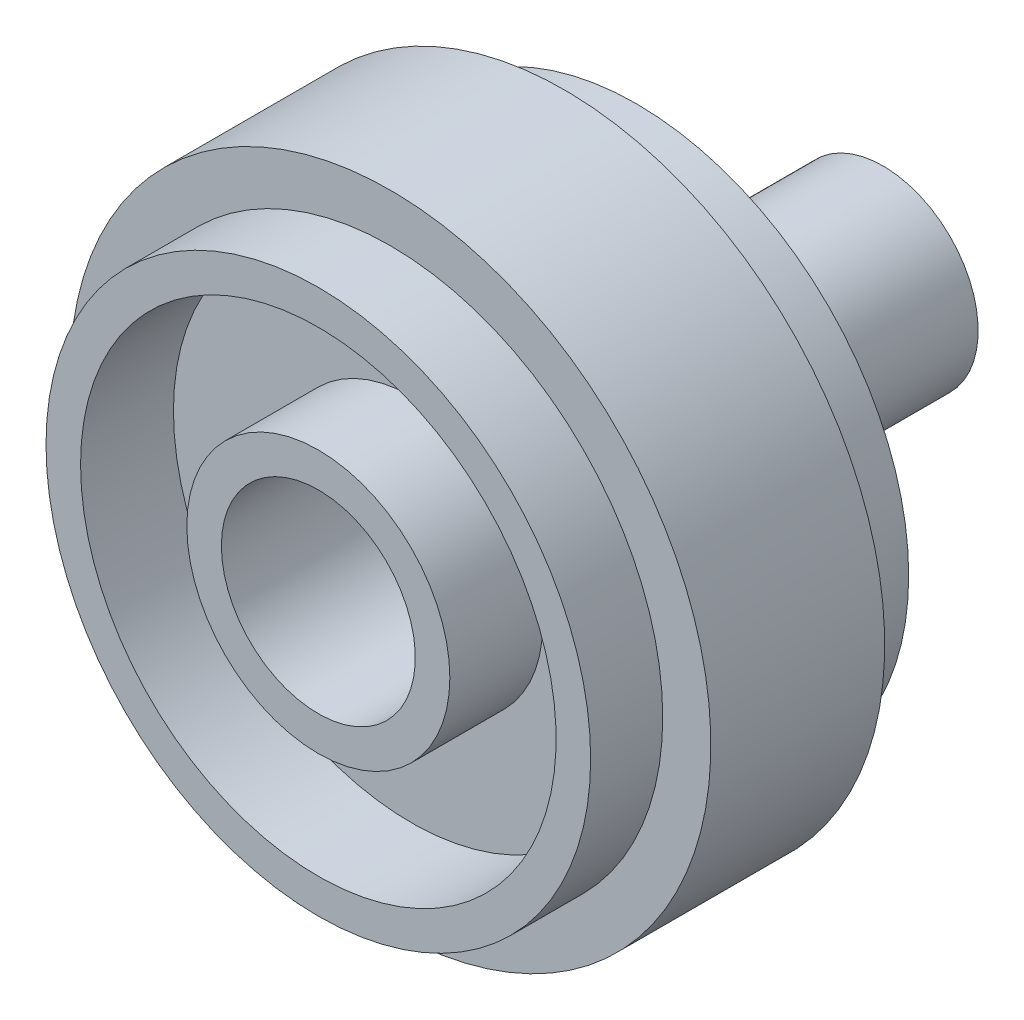
from build123d import *


with BuildPart() as part:
    # Sketch1 → Revolve1 (revolve)
    with BuildSketch(Plane(origin=(0, 0, 0), x_dir=(0, 0, -1), z_dir=(1, 0, 0)), mode=Mode.PRIVATE) as revolve1_sk:
        Polygon((2.9718, 10.95375), (-2.9718, 10.95375), (-2.9718, 9.3091), (-5.4356, 9.3091), (-5.4356, 8.128), (-2.2606, 8.128), (-2.2606, 4.4958), (-5.4356, 4.4958), (-5.4356, 3.3147), (1.1938, 3.3147), (1.1938, 1.55575), (13.8684, 1.55575), (13.8684, 3.2512), (2.2225, 3.2512), (2.2225, 4.4958), (-0.5207, 4.4958), (-0.5207, 8.128), (5.4356, 8.128), (5.4356, 9.3091), (2.9718, 9.3091), align=None)
    revolve(revolve1_sk.sketch.rotate(Axis((0, 0, 0), (0, 0, 1)), 90), axis=Axis((0, 0, 0), (0, 0, 1)))


solid = part.part
